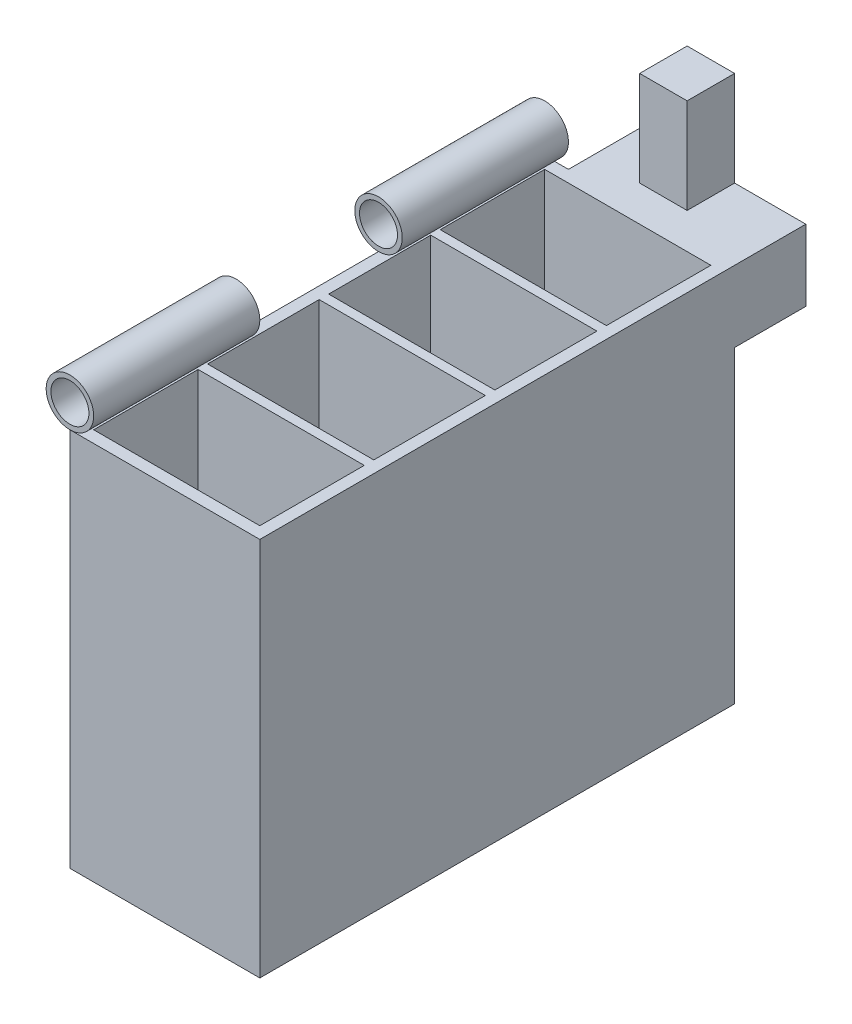
from build123d import *

# Parameters (mm, degrees)
SKETCH1_W           = 40
SKETCH1_H           = 80
BOSS_EXTRUDE1_DEPTH = 50
SKETCH2_W           = 35
SKETCH2_H           = 22
SKETCH2_H_2         = 23.5
SKETCH2_H_3         = 21.5
CUT_EXTRUDE2_DEPTH  = 75
SKETCH7_W           = 35
SKETCH7_H           = 5
SKETCH9_R           = 4
CUT_EXTRUDE3_DEPTH  = 35
SKETCH12_R          = 5
SKETCH12_R_2        = 4
BOSS_EXTRUDE2_DEPTH = 35
SKETCH14_W          = 15
SKETCH14_H          = 15
BOSS_EXTRUDE3_DEPTH = 35
SKETCH15_W          = 10
SKETCH15_H          = 35
BOSS_EXTRUDE4_DEPTH = 10


with BuildPart() as part:
    # Sketch1 → Boss-Extrude1 (new, symmetric)
    with BuildSketch(Plane.XY):
        Rectangle(SKETCH1_W, SKETCH1_H)
    extrude(amount=BOSS_EXTRUDE1_DEPTH, both=True)

    # Sketch2 → Cut-Extrude2 (cut)
    with BuildSketch(Plane(origin=(0, 40, 0), x_dir=(1, 0, 0), z_dir=(0, 1, 0))):
        with Locations((0, -36.5)):
            Rectangle(SKETCH2_W, SKETCH2_H)
        with Locations((0, -11.75)):
            Rectangle(SKETCH2_W, SKETCH2_H_2)
        with Locations((0, 12.75)):
            Rectangle(SKETCH2_W, SKETCH2_H_3)
        with Locations((0, 36.5)):
            Rectangle(SKETCH2_W, SKETCH2_H)
    extrude(amount=-CUT_EXTRUDE2_DEPTH, mode=Mode.SUBTRACT)

    # Sketch14 → Boss-Extrude3 (add)
    with BuildSketch(Plane(origin=(20, 0, 0), x_dir=(0, 0, -1), z_dir=(1, 0, 0))):
        with Locations((57.5, 32.5)):
            Rectangle(SKETCH14_W, SKETCH14_H)
    extrude(amount=-BOSS_EXTRUDE3_DEPTH)

    # Sketch15 → Boss-Extrude4 (add)
    with BuildSketch(Plane(origin=(0, 0, -65), x_dir=(-1, 0, 0), z_dir=(0, 0, -1))):
        with Locations((0, 42.5)):
            Rectangle(SKETCH15_W, SKETCH15_H)
    extrude(amount=-BOSS_EXTRUDE4_DEPTH)


with BuildPart() as body_2:
    # Sketch7 → Revolve-Thin1 (revolve)
    with BuildSketch(Plane.ZY.offset(20)):
        with Locations((32.5, 42.5)):
            Rectangle(SKETCH7_W, SKETCH7_H)
    revolve(axis=Axis((-20, 45, 50), (0, 0, -1)))

    # Sketch9 → Cut-Extrude3 (cut)
    with BuildSketch(Plane.XY.offset(50)):
        with Locations((-20, 45)):
            Circle(SKETCH9_R)
    extrude(amount=-CUT_EXTRUDE3_DEPTH, mode=Mode.SUBTRACT)


with BuildPart() as body_3:
    # Sketch12 → Boss-Extrude2 (new body)
    with BuildSketch(Plane(origin=(0, 0, -50), x_dir=(-1, 0, 0), z_dir=(0, 0, -1))):
        with Locations((20, 45)):
            Circle(SKETCH12_R)
        with Locations((20, 45)):
            Circle(SKETCH12_R_2, mode=Mode.SUBTRACT)
    extrude(amount=-BOSS_EXTRUDE2_DEPTH)


solid = Compound([part.part, body_2.part, body_3.part])
